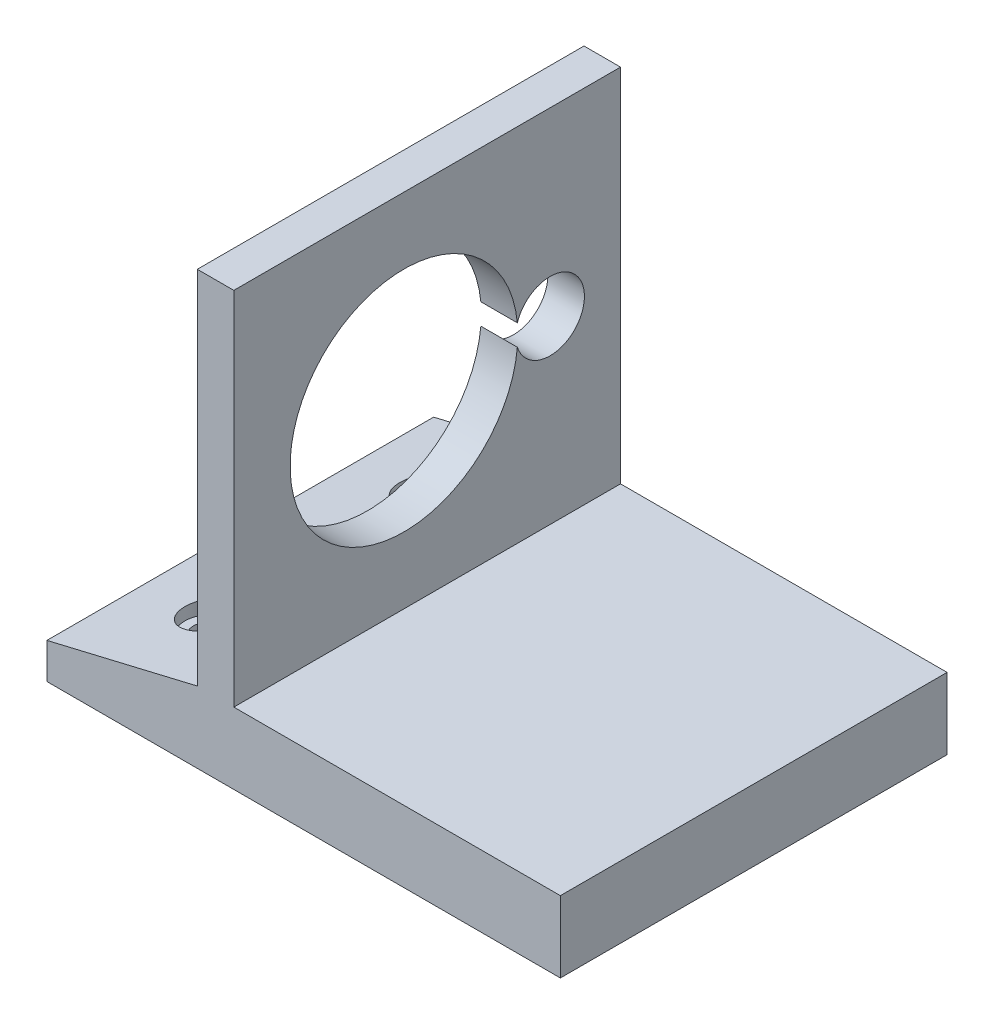
from build123d import *

# Parameters (mm, degrees)
BOSS_EXTRU_1_DEPTH      = 45
ESQUISSE3_R             = 2
ENL_V_MAT_EXTRU_2_DEPTH = 91.138958208
ESQUISSE4_R             = 3
ENL_V_MAT_EXTRU_3_DEPTH = 46.15
ENL_V_MAT_EXTRU_4_DEPTH = 609.201213002


with BuildPart() as part:
    # Esquisse1 → Boss.-Extru.1 (new body)
    with BuildSketch(Plane.XY):
        Polygon((-38, -554.760879723), (-38, -596.760879723), (0, -596.760879723), (0, -605.060879723), (-59.74898984, -605.060879723), (-59.74898984, -600.910879723), (-42.249820419, -596.760879723), (-42.249820419, -554.760879723), align=None)
    extrude(amount=-BOSS_EXTRU_1_DEPTH)

    # Esquisse3 → Enlèv. mat.-Extru.2 (cut, through all)
    with BuildSketch(Plane.XZ.offset(605.060879723)):
        with Locations(Location((-50.683510071, -35, 0), (0, 0, 270))):
            Circle(ESQUISSE3_R)
        with Locations(Location((-50.683510071, -10, 0), (0, 0, 270))):
            Circle(ESQUISSE3_R)
    extrude(amount=-ENL_V_MAT_EXTRU_2_DEPTH, mode=Mode.SUBTRACT)

    # Esquisse4 → Enlèv. mat.-Extru.3 (cut)
    with BuildSketch(Plane(origin=(0, -554.760879723, 0), x_dir=(1, 0, 0), z_dir=(0, 1, 0))):
        with Locations(Location((-50.683510071, 10, 0), (0, 0, 270))):
            Circle(ESQUISSE4_R)
        with Locations(Location((-50.683510071, 35, 0), (0, 0, 270))):
            Circle(ESQUISSE4_R)
    extrude(amount=-ENL_V_MAT_EXTRU_3_DEPTH, mode=Mode.SUBTRACT)

    # Esquisse5 → Enlèv. mat.-Extru.4 (cut, through all)
    with BuildSketch(Plane.ZY.offset(42.249820419)):
        with BuildLine():
            ThreePointArc((-32.993014669, -574.533336367), (-40.8, -575.760879723), (-32.993014669, -576.98842308))
            ThreePointArc((-32.993014669, -576.98842308), (-6.549999953, -575.760879723), (-32.993014669, -574.533336367))
        make_face()
    extrude(amount=-ENL_V_MAT_EXTRU_4_DEPTH, mode=Mode.SUBTRACT)


solid = part.part
